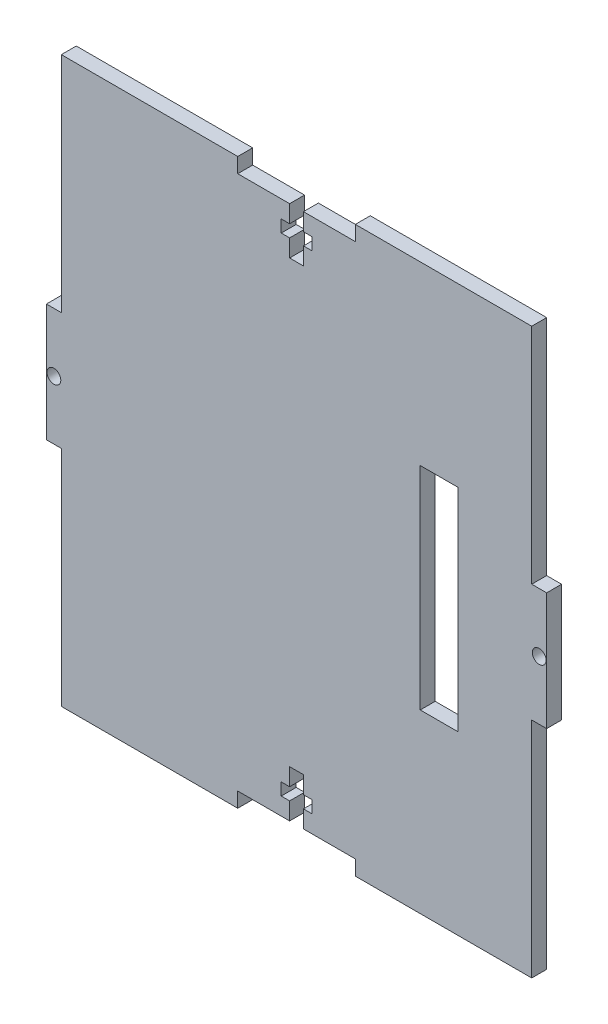
from build123d import *

# Parameters (mm, degrees)
SKETCH1_R           = 1.47
BOSS_EXTRUDE1_DEPTH = 1.5875
SKETCH3_W           = 8
SKETCH3_H           = 45
CUT_EXTRUDE1_DEPTH  = 81.235037546


with BuildPart() as part:
    # Sketch1 → Boss-Extrude1 (new, symmetric)
    with BuildSketch(Plane.XY):
        Polygon((-12.5, 60), (-50, 60), (-50, 12.5), (-53.175, 12.5), (-53.175, -12.5), (-50, -12.5), (-50, -60), (-12.5, -60), (-12.5, -56.825), (-1.47, -56.825), (-1.47, -53.125), (-3.25, -53.125), (-3.25, -50.525), (-1.47, -50.525), (-1.47, -46.825), (1.47, -46.825), (1.47, -50.525), (3.25, -50.525), (3.25, -53.125), (1.47, -53.125), (1.47, -56.825), (12.5, -56.825), (12.5, -60), (50, -60), (50, -12.5), (53.175, -12.5), (53.175, 12.5), (50, 12.5), (50, 60), (12.5, 60), (12.5, 56.825), (1.47, 56.825), (1.47, 53.125), (3.25, 53.125), (3.25, 50.525), (1.47, 50.525), (1.47, 46.825), (-1.47, 46.825), (-1.47, 50.525), (-3.25, 50.525), (-3.25, 53.125), (-1.47, 53.125), (-1.47, 56.825), (-12.5, 56.825), align=None)
        with Locations((-51.5875, 0)):
            Circle(SKETCH1_R, mode=Mode.SUBTRACT)
        with Locations(Location((51.5875, 0, 0), (0, 0, 180))):
            Circle(SKETCH1_R, mode=Mode.SUBTRACT)
    extrude(amount=BOSS_EXTRUDE1_DEPTH, both=True)

    # Sketch3 → Cut-Extrude1 (cut, through all)
    with BuildSketch(Plane(origin=(0, 0, -1.5875), x_dir=(-1, 0, 0), z_dir=(0, 0, -1))):
        with Locations((-30.3, 0)):
            Rectangle(SKETCH3_W, SKETCH3_H)
    extrude(amount=-CUT_EXTRUDE1_DEPTH, mode=Mode.SUBTRACT)


solid = part.part
